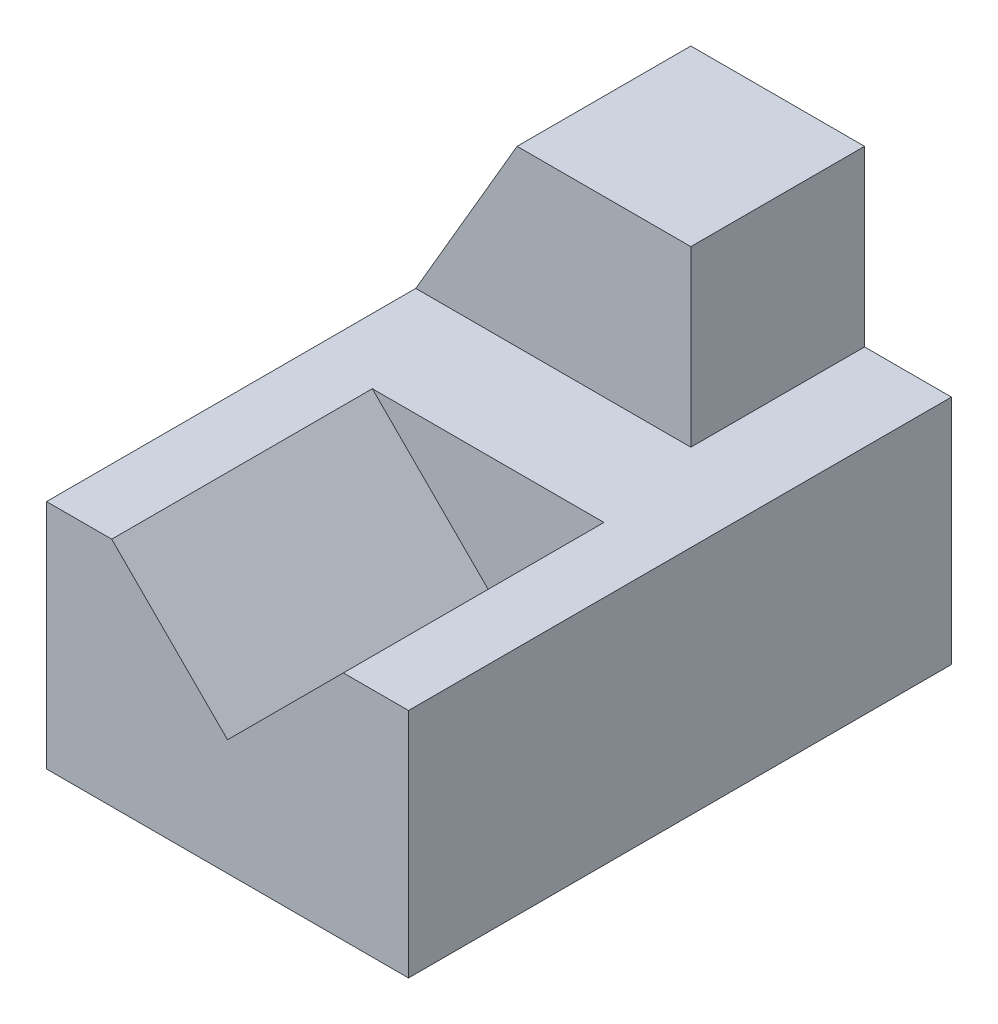
from build123d import *

# Parameters (mm, degrees)
BOSS_EXTRUDE1_DEPTH = 75
BOSS_EXTRUDE3_DEPTH = 39
BOSS_EXTRUDE4_DEPTH = 24


with BuildPart() as part:
    # Sketch1 → Boss-Extrude1 (new body)
    with BuildSketch(Plane.XY):
        Polygon((25, -28), (25, 4), (16, 4), (0, -12), (-16, 4), (-25, 4), (-25, -28), align=None)
    extrude(amount=BOSS_EXTRUDE1_DEPTH)

    # Sketch1<4> → Boss-Extrude3 (add)
    with BuildSketch(Plane.XY):
        Polygon((0, -12), (16, 4), (13, 4), (-16, 4), align=None)
    extrude(amount=BOSS_EXTRUDE3_DEPTH)

    # Sketch1<5> → Boss-Extrude4 (add)
    with BuildSketch(Plane.XY):
        Polygon((-16, 4), (13, 4), (13, 28), (-11, 28), (-25, 4), align=None)
    extrude(amount=BOSS_EXTRUDE4_DEPTH)


solid = part.part
